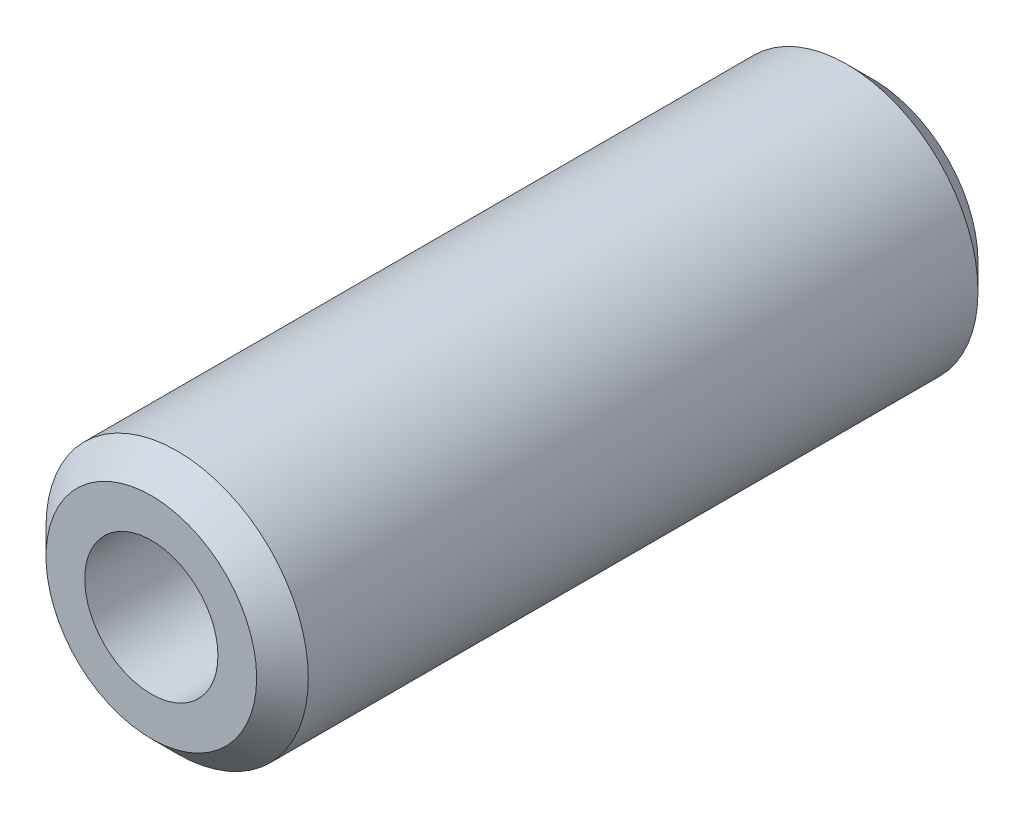
from build123d import *

# Parameters (mm, degrees)
SKETCH1_R           = 12.7
BOSS_EXTRUDE1_DEPTH = 69.85
SKETCH2_R           = 6.45
CUT_EXTRUDE1_DEPTH  = 73.122135992
CHAMFER1_SIZE       = 2.5


with BuildPart() as part:
    # Sketch1 → Boss-Extrude1 (new body)
    with BuildSketch(Plane.XY):
        Circle(SKETCH1_R)
    extrude(amount=BOSS_EXTRUDE1_DEPTH)

    # Sketch2 → Cut-Extrude1 (cut, through all)
    with BuildSketch(Plane.XY.offset(69.85)):
        Circle(SKETCH2_R)
    extrude(amount=-CUT_EXTRUDE1_DEPTH, mode=Mode.SUBTRACT)

    # Chamfer1
    chamfer1_edges = [part.edges().sort_by_distance(p)[0] for p in [
        (-12.7, 0, 0),
        (-12.7, 0, 69.85),
    ]]
    chamfer(chamfer1_edges, length=CHAMFER1_SIZE)


solid = part.part
